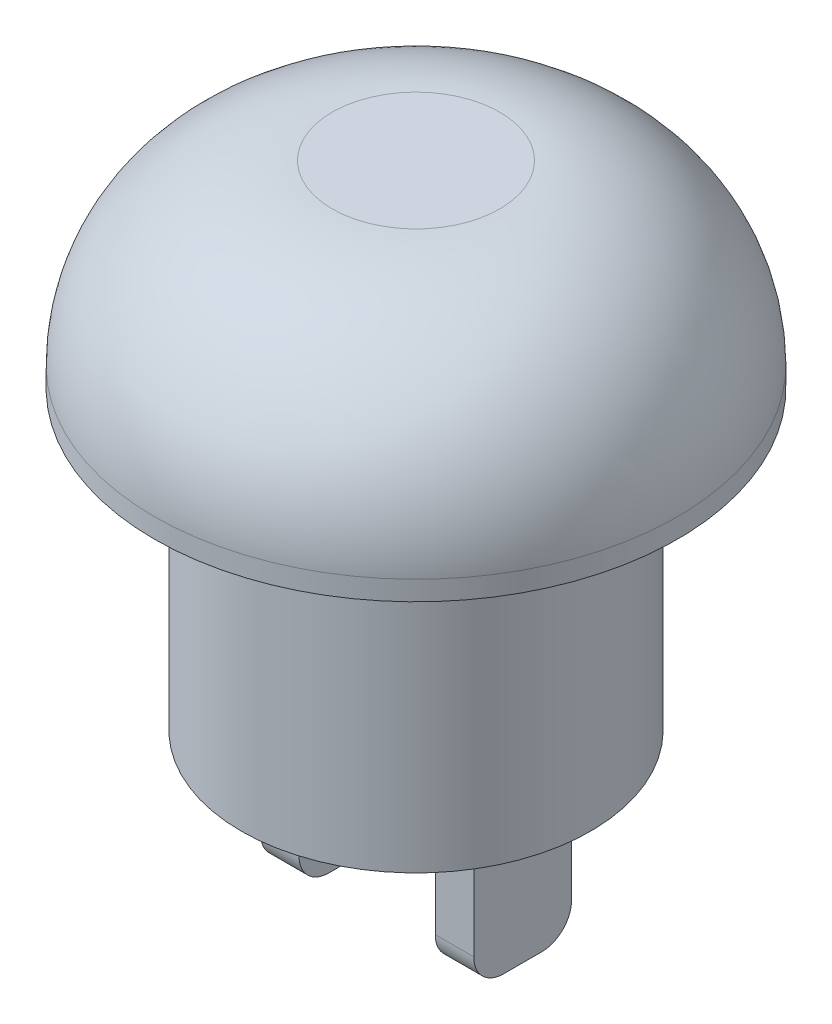
from build123d import *

# Parameters (mm, degrees)
SKETCH1_R           = 5.9
BOSS_EXTRUDE1_DEPTH = 10
SKETCH2_R           = 8.83
BOSS_EXTRUDE2_DEPTH = 6.66
FILLET1_R           = 6
SKETCH3_W           = 1.3
SKETCH3_H           = 1.65
BOSS_EXTRUDE3_DEPTH = 5
FILLET2_R           = 1


with BuildPart() as part:
    # Sketch1 → Boss-Extrude1 (new body)
    with BuildSketch(Plane(origin=(0, 0, 0), x_dir=(1, 0, 0), z_dir=(0, 1, 0))):
        with Locations(Location((0, 0, 0), (0, 0, 270))):
            Circle(SKETCH1_R)
    extrude(amount=BOSS_EXTRUDE1_DEPTH)

    # Sketch2 → Boss-Extrude2 (add)
    with BuildSketch(Plane(origin=(0, 10, 0), x_dir=(1, 0, 0), z_dir=(0, 1, 0))):
        with Locations(Location((0, 0, 0), (0, 0, 270))):
            Circle(SKETCH2_R)
    extrude(amount=BOSS_EXTRUDE2_DEPTH)

    # Fillet1
    fillet1_edges = [part.edges().sort_by_distance(p)[0] for p in [
        (0, 16.66, -8.83),
    ]]
    fillet(fillet1_edges, radius=FILLET1_R)

    # Sketch3 → Boss-Extrude3 (add)
    with BuildSketch(Plane.XZ):
        with Locations((2.95, -0.825)):
            Rectangle(SKETCH3_W, SKETCH3_H)
        with Locations((2.95, 0.825)):
            Rectangle(SKETCH3_W, SKETCH3_H)
        with Locations((-2.95, 0.825)):
            Rectangle(SKETCH3_W, SKETCH3_H)
        with Locations((-2.95, -0.825)):
            Rectangle(SKETCH3_W, SKETCH3_H)
    extrude(amount=BOSS_EXTRUDE3_DEPTH)

    # Fillet2
    fillet2_edges = [part.edges().sort_by_distance(p)[0] for p in [
        (2.95, -5, -1.65),
        (2.95, -5, 1.65),
        (-2.95, -5, 1.65),
        (-2.95, -5, -1.65),
    ]]
    fillet(fillet2_edges, radius=FILLET2_R)


solid = part.part
